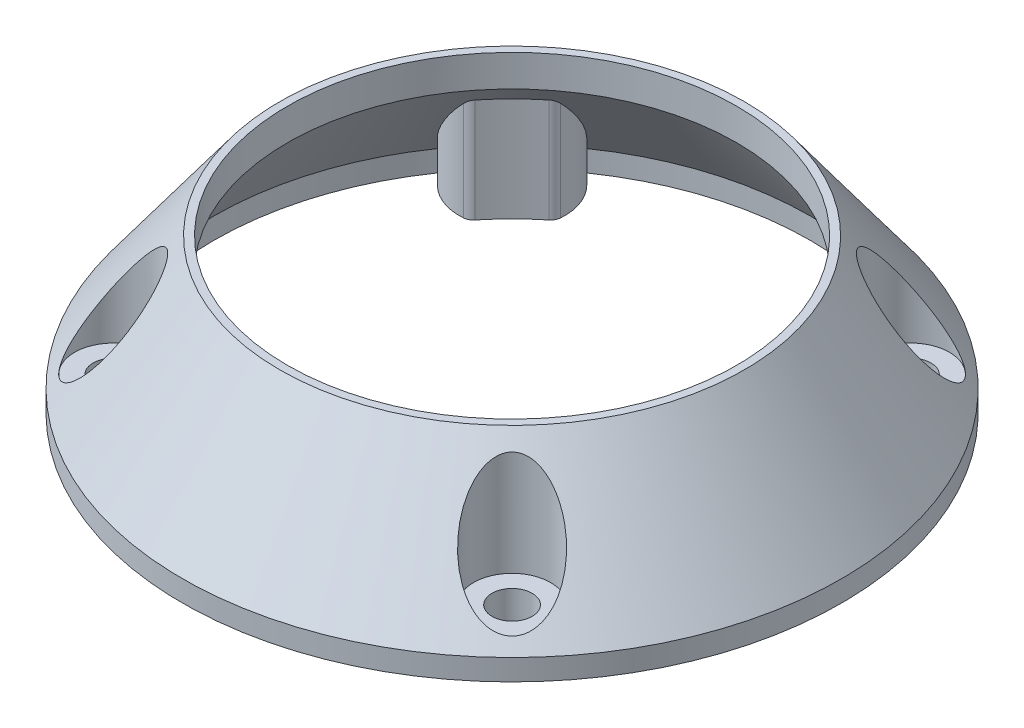
from build123d import *

# Parameters (mm, degrees)
BOSS_EXTRUDE2_REACH = 61.404
SKETCH6_R           = 2.413
CUT_EXTRUDE3_DEPTH  = 60.403601076
SKETCH7_R           = 4.6355
CUT_EXTRUDE6_DEPTH  = 15.723362
SKETCH8_R           = 51.318264322
CUT_EXTRUDE7_DEPTH  = 1.27
FILLET1_R           = 1.27


with BuildPart() as part:
    # Sketch3 → Revolve1 (revolve)
    with BuildSketch(Plane.XY, mode=Mode.PRIVATE) as revolve1_sk:
        Polygon((35.89, 0), (27, 12.094590252), (27, 17.174590252), (39.624, 0), (39.624, -2.54), (35.89, -2.54), align=None)
    revolve(revolve1_sk.sketch.rotate(Axis((0, -74.58294497, 0), (0, 1, 0)), 90), axis=Axis((0, -74.58294497, 0), (0, 1, 0)))

    # Boss-Extrude2: up to this cone (the profile starts inside it)
    boss_extrude2_end = Plane(origin=(0, -2.54, 0), z_dir=(0, -1, 0)).offset(-51.367315551) * Cone(1e-06, 111.011758661, 151.028315551, align=(Align.CENTER, Align.CENTER, Align.MIN), mode=Mode.PRIVATE)
    # Sketch4 → Boss-Extrude2 (add, up to the surface)
    with BuildSketch(Plane.XZ.offset(2.54), mode=Mode.PRIVATE) as boss_extrude2_sk1:
        with BuildLine():
            Line((-19.217748099, 28.19800422), (-20.487557981, 29.467814102))
            ThreePointArc((-20.487557981, 29.467814102), (-25.378062377, 25.378062377), (-29.467814102, 20.487557981))
            Line((-29.467814102, 20.487557981), (-28.19800422, 19.217748099))
            ThreePointArc((-28.19800422, 19.217748099), (-25.628248167, 17.655217954), (-22.627714101, 17.450420612))
            ThreePointArc((-22.627714101, 17.450420612), (-20.205576272, 20.205576272), (-17.450420612, 22.627714101))
            ThreePointArc((-17.450420612, 22.627714101), (-17.655217954, 25.628248167), (-19.217748099, 28.19800422))
        make_face()
    boss_extrude2_tool1 = extrude(boss_extrude2_sk1.sketch, amount=-BOSS_EXTRUDE2_REACH, mode=Mode.PRIVATE) & boss_extrude2_end
    add(boss_extrude2_tool1.solids().sort_by_distance((-22.84989, -2.54, 22.84989))[0])
    # Sketch4 → Boss-Extrude2 (add, up to the surface)
    with BuildSketch(Plane.XZ.offset(2.54), mode=Mode.PRIVATE) as boss_extrude2_sk2:
        with BuildLine():
            Line((28.19800422, 19.217748099), (29.467814102, 20.487557981))
            ThreePointArc((29.467814102, 20.487557981), (25.378062377, 25.378062377), (20.487557981, 29.467814102))
            Line((20.487557981, 29.467814102), (19.217748099, 28.19800422))
            ThreePointArc((19.217748099, 28.19800422), (17.655217954, 25.628248167), (17.450420612, 22.627714101))
            ThreePointArc((17.450420612, 22.627714101), (20.205576272, 20.205576272), (22.627714101, 17.450420612))
            ThreePointArc((22.627714101, 17.450420612), (25.628248167, 17.655217954), (28.19800422, 19.217748099))
        make_face()
    boss_extrude2_tool2 = extrude(boss_extrude2_sk2.sketch, amount=-BOSS_EXTRUDE2_REACH, mode=Mode.PRIVATE) & boss_extrude2_end
    add(boss_extrude2_tool2.solids().sort_by_distance((22.84989, -2.54, 22.84989))[0])
    # Sketch4 → Boss-Extrude2 (add, up to the surface)
    with BuildSketch(Plane.XZ.offset(2.54), mode=Mode.PRIVATE) as boss_extrude2_sk3:
        with BuildLine():
            Line((19.217748099, -28.19800422), (20.487557981, -29.467814102))
            ThreePointArc((20.487557981, -29.467814102), (25.378062377, -25.378062377), (29.467814102, -20.487557981))
            Line((29.467814102, -20.487557981), (28.19800422, -19.217748099))
            ThreePointArc((28.19800422, -19.217748099), (25.628248167, -17.655217954), (22.627714101, -17.450420612))
            ThreePointArc((22.627714101, -17.450420612), (20.205576272, -20.205576272), (17.450420612, -22.627714101))
            ThreePointArc((17.450420612, -22.627714101), (17.655217954, -25.628248167), (19.217748099, -28.19800422))
        make_face()
    boss_extrude2_tool3 = extrude(boss_extrude2_sk3.sketch, amount=-BOSS_EXTRUDE2_REACH, mode=Mode.PRIVATE) & boss_extrude2_end
    add(boss_extrude2_tool3.solids().sort_by_distance((22.84989, -2.54, -22.84989))[0])
    # Sketch4 → Boss-Extrude2 (add, up to the surface)
    with BuildSketch(Plane.XZ.offset(2.54), mode=Mode.PRIVATE) as boss_extrude2_sk4:
        with BuildLine():
            Line((-28.19800422, -19.217748099), (-29.467814102, -20.487557981))
            ThreePointArc((-29.467814102, -20.487557981), (-25.378062377, -25.378062377), (-20.487557981, -29.467814102))
            Line((-20.487557981, -29.467814102), (-19.217748099, -28.19800422))
            ThreePointArc((-19.217748099, -28.19800422), (-17.655217954, -25.628248167), (-17.450420612, -22.627714101))
            ThreePointArc((-17.450420612, -22.627714101), (-20.205576272, -20.205576272), (-22.627714101, -17.450420612))
            ThreePointArc((-22.627714101, -17.450420612), (-25.628248167, -17.655217954), (-28.19800422, -19.217748099))
        make_face()
    boss_extrude2_tool4 = extrude(boss_extrude2_sk4.sketch, amount=-BOSS_EXTRUDE2_REACH, mode=Mode.PRIVATE) & boss_extrude2_end
    add(boss_extrude2_tool4.solids().sort_by_distance((-22.84989, -2.54, -22.84989))[0])

    # Sketch6 → Cut-Extrude3 (cut, through all)
    with BuildSketch(Plane.XZ.offset(2.54)):
        with Locations(Location((-23.977283843, 23.977283843, 0), (0, 0, 270))):
            Circle(SKETCH6_R)
        with Locations(Location((23.977283843, 23.977283843, 0), (0, 0, 45))):
            Circle(SKETCH6_R)
        with Locations(Location((23.977283843, -23.977283843, 0), (0, 0, 270))):
            Circle(SKETCH6_R)
        with Locations(Location((-23.977283843, -23.977283843, 0), (0, 0, 225))):
            Circle(SKETCH6_R)
    extrude(amount=-CUT_EXTRUDE3_DEPTH, mode=Mode.SUBTRACT)

    # Sketch7 → Cut-Extrude6 (cut)
    with BuildSketch(Plane(origin=(0, 17.174590252, 0), x_dir=(1, 0, 0), z_dir=(0, 1, 0))):
        with Locations(Location((-23.977283843, 23.977283843, 0), (0, 0, 270))):
            Circle(SKETCH7_R)
        with Locations(Location((23.977283843, 23.977283843, 0), (0, 0, 270))):
            Circle(SKETCH7_R)
        with Locations(Location((23.977283843, -23.977283843, 0), (0, 0, 270))):
            Circle(SKETCH7_R)
        with Locations(Location((-23.977283843, -23.977283843, 0), (0, 0, 270))):
            Circle(SKETCH7_R)
    extrude(amount=-CUT_EXTRUDE6_DEPTH, mode=Mode.SUBTRACT)

    # Sketch8 → Cut-Extrude7 (cut)
    with BuildSketch(Plane(origin=(0, 17.174590252, 0), x_dir=(1, 0, 0), z_dir=(0, 1, 0))):
        Circle(SKETCH8_R)
    extrude(amount=-CUT_EXTRUDE7_DEPTH, mode=Mode.SUBTRACT)

    # Fillet1
    fillet1_edges = [part.edges().sort_by_distance(p)[0] for p in [
        (22.627714101, 3.705924076, -17.450420612),
        (17.450420612, 3.705924076, -22.627714101),
        (-22.627714101, 3.705924076, -17.450420612),
        (-17.450420612, 3.705924076, -22.627714101),
        (-22.627714101, 3.705924076, 17.450420612),
        (-17.450420612, 3.705924076, 22.627714101),
        (17.450420612, 3.705924076, 22.627714101),
        (22.627714101, 3.705924076, 17.450420612),
    ]]
    fillet(fillet1_edges, radius=FILLET1_R)


solid = part.part
